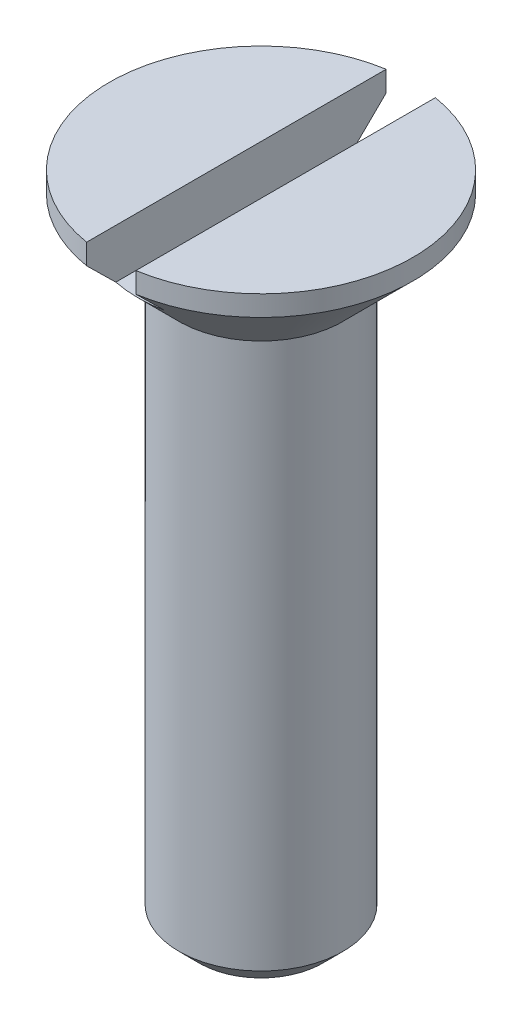
from build123d import *

# Parameters (mm, degrees)
CUT_EXTRUDE_1_DEPTH      = 17.83389438
CUT_EXTRUDE_1_DEPTH_BACK = 17.83389438
SKETCH_2_W               = 1.2
SKETCH_2_H               = 1.2


with BuildPart() as part:
    # Эскиз1 → Повернуть1 (revolve)
    with BuildSketch(Plane.XY):
        Polygon((0, 0), (-1.5, 0), (-2, 0.5), (-2, 13.8), (-3.7, 15.5), (-3.7, 16), (0, 16), align=None)
    revolve(axis=Axis((0, 16, 0), (0, -1, 0)))

    # Эскиз2 → Вырез-Вытянуть1 (cut, two sides: drawn at the far end of the back side and taken through both)
    with BuildSketch(Plane.XY.offset(-CUT_EXTRUDE_1_DEPTH_BACK)):
        with Locations((0, 15.4)):
            Rectangle(SKETCH_2_W, SKETCH_2_H)
    extrude(amount=CUT_EXTRUDE_1_DEPTH + CUT_EXTRUDE_1_DEPTH_BACK, mode=Mode.SUBTRACT)


solid = part.part
